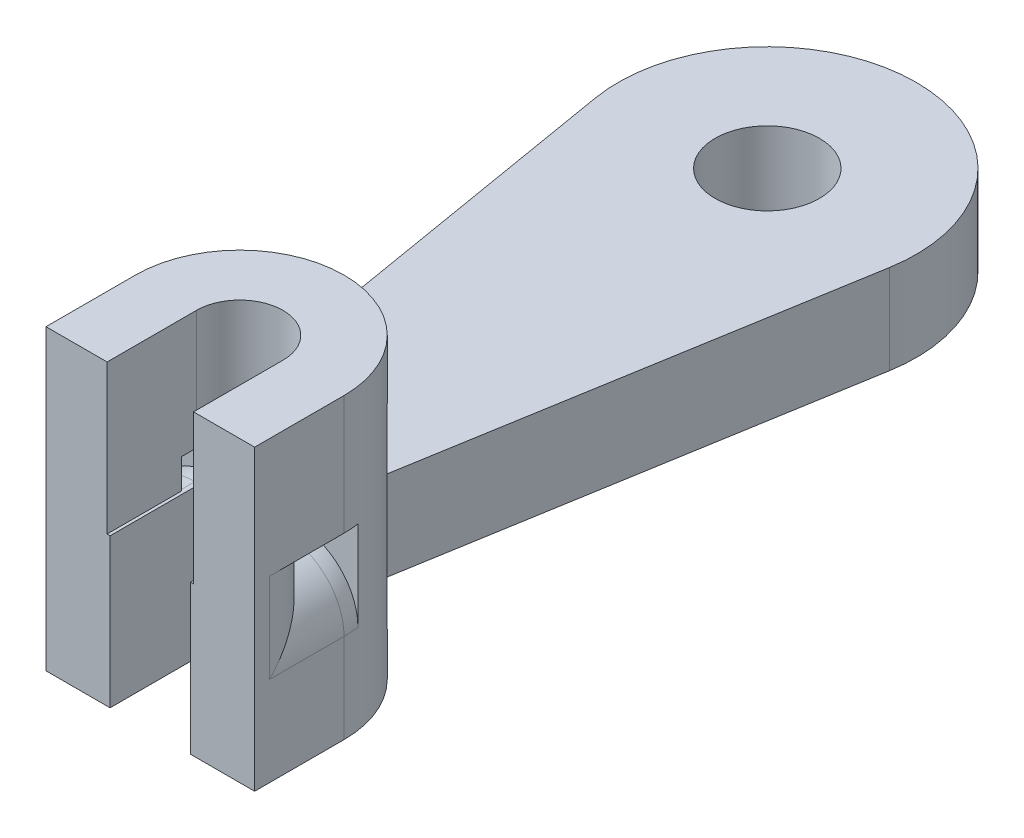
from build123d import *

# Parameters (mm, degrees)
BOSS_EXTRUDE1_DEPTH     = 5
BOSS_EXTRUDE2_DEPTH     = 5
CUT_EXTRUDE1_DEPTH      = 12.694122455
CUT_EXTRUDE1_DEPTH_BACK = 12.694122455
SKETCH3_W               = 1
SKETCH3_H               = 1
FILLET1_R               = 2
BOSS_EXTRUDE3_START     = 3
SKETCH4_R               = 1.75
BOSS_EXTRUDE3_DEPTH     = 3


with BuildPart() as part:
    # Sketch1 → Boss-Extrude1 (new body)
    with BuildSketch(Plane(origin=(0, 0, 0), x_dir=(1, 0, 0), z_dir=(0, 1, 0))):
        with BuildLine():
            Line((-1.35, 0), (-1.35, -3))
            Line((-1.35, -3), (-3.5, -3))
            Line((-3.5, -3), (-3.5, 0))
            ThreePointArc((-3.5, 0), (0, 3.5), (3.5, 0))
            Line((3.5, 0), (3.5, -3))
            Line((3.5, -3), (1.35, -3))
            Line((1.35, -3), (1.35, 0))
            ThreePointArc((1.35, 0), (0, 1.35), (-1.35, 0))
        make_face()
    extrude(amount=BOSS_EXTRUDE1_DEPTH)

    # Sketch2 → Boss-Extrude2 (add)
    with BuildSketch(Plane(origin=(0, 5, 0), x_dir=(1, 0, 0), z_dir=(0, 1, 0))):
        with BuildLine():
            Line((-1.45, -2.9), (-1.45, 0))
            ThreePointArc((-1.45, 0), (0, 1.45), (1.45, 0))
            Line((1.45, 0), (1.45, -2.9))
            Line((1.45, -2.9), (1.45, -3))
            Line((1.45, -3), (3.5, -3))
            Line((3.5, -3), (3.5, 0))
            ThreePointArc((3.5, 0), (0, 3.5), (-3.5, 0))
            Line((-3.5, 0), (-3.5, -3))
            Line((-3.5, -3), (-1.45, -3))
            Line((-1.45, -3), (-1.45, -2.9))
        make_face()
    extrude(amount=BOSS_EXTRUDE2_DEPTH)

    # Sketch3 → Cut-Extrude1 (cut, two sides: drawn at the far end of the back side and taken through both)
    with BuildSketch(Plane(origin=(-1.45, 0, 0), x_dir=(0, 0, -1), z_dir=(1, 0, 0)).offset(-CUT_EXTRUDE1_DEPTH_BACK)):
        with Locations((0, 5.5)):
            Rectangle(SKETCH3_W, SKETCH3_H)
    extrude(amount=CUT_EXTRUDE1_DEPTH + CUT_EXTRUDE1_DEPTH_BACK, mode=Mode.SUBTRACT)

    # Fillet1
    fillet1_edges = [part.edges().sort_by_distance(p)[0] for p in [
        (3.5, 5.5, 0.5),
        (3.5, 5, 0.25),
        (-3.5, 5.5, 0.5),
        (3.491013868, 5, -0.250643519),
        (-3.5, 5, 0.25),
        (-3.491013868, 5, -0.250643519),
    ]]
    fillet(fillet1_edges, radius=FILLET1_R)

    # Sketch4 → Boss-Extrude3 (add)
    with BuildSketch(Plane.XZ.offset(-6).offset(BOSS_EXTRUDE3_START)):
        with BuildLine():
            Line((-4.930452649, -16.86895447), (-2.5, -2.449489743))
            ThreePointArc((-2.5, -2.449489743), (0, -3.5), (2.5, -2.449489743))
            Line((2.5, -2.449489743), (4.930452649, -16.86895447))
            ThreePointArc((4.930452649, -16.86895447), (0, -22.7), (-4.930452649, -16.86895447))
        make_face()
        with Locations(Location((0, -17.7, 0), (0, 0, 270))):
            Circle(SKETCH4_R, mode=Mode.SUBTRACT)
    extrude(amount=-BOSS_EXTRUDE3_DEPTH)


solid = part.part
